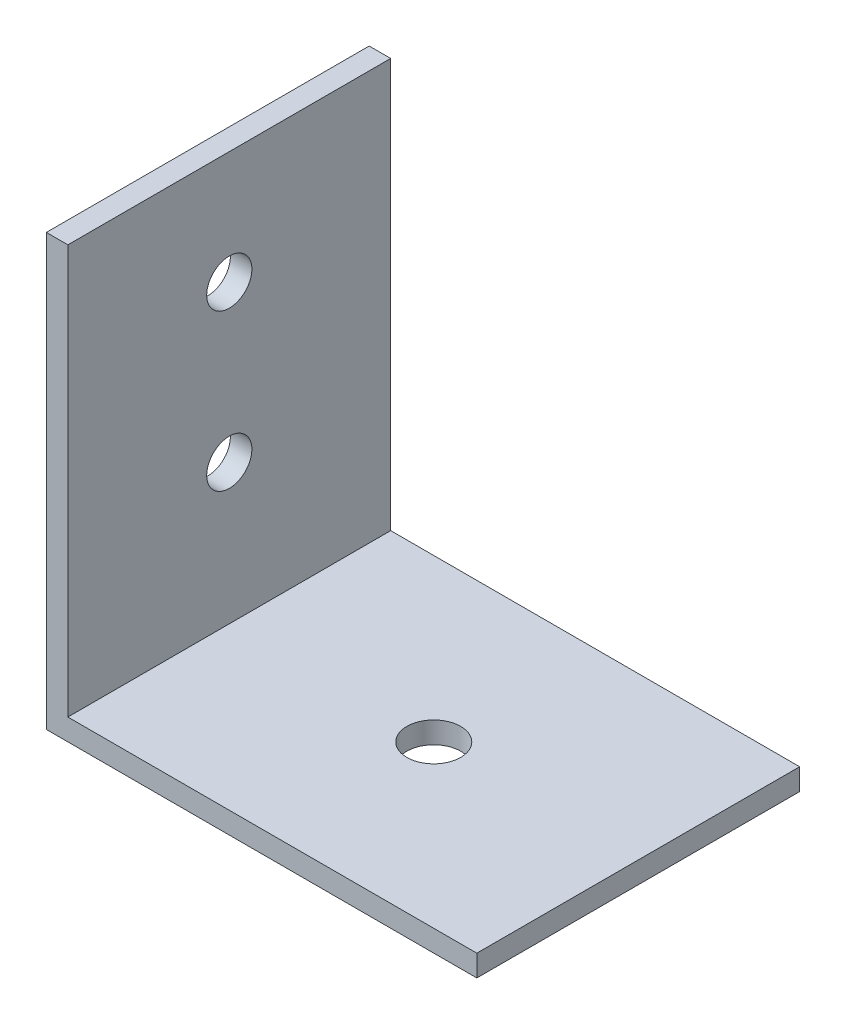
from build123d import *

# Parameters (mm, degrees)
BOSS_EXTRUDE1_DEPTH = 30
SKETCH2_R           = 2.1
CUT_EXTRUDE1_DEPTH  = 30
SKETCH3_R           = 2.5
CUT_EXTRUDE2_DEPTH  = 10


with BuildPart() as part:
    # Sketch1 → Boss-Extrude1 (new body)
    with BuildSketch(Plane.XY):
        Polygon((-8, 5), (-8, -33), (30, -33), (30, -35), (-10, -35), (-10, 5), align=None)
    extrude(amount=BOSS_EXTRUDE1_DEPTH)

    # Sketch2 → Cut-Extrude1 (cut)
    with BuildSketch(Plane(origin=(-8, 0, 0), x_dir=(0, 0, -1), z_dir=(1, 0, 0))):
        with Locations(Location((-15, -5.5, 0), (0, 0, 90))):
            Circle(SKETCH2_R)
        with Locations(Location((-15, -20, 0), (0, 0, 90))):
            Circle(SKETCH2_R)
    extrude(amount=-CUT_EXTRUDE1_DEPTH, mode=Mode.SUBTRACT)

    # Sketch3 → Cut-Extrude2 (cut)
    with BuildSketch(Plane(origin=(0, -33, 0), x_dir=(1, 0, 0), z_dir=(0, 1, 0))):
        with Locations(Location((11, -15, 0), (0, 0, 270))):
            Circle(SKETCH3_R)
    extrude(amount=-CUT_EXTRUDE2_DEPTH, mode=Mode.SUBTRACT)


solid = part.part
